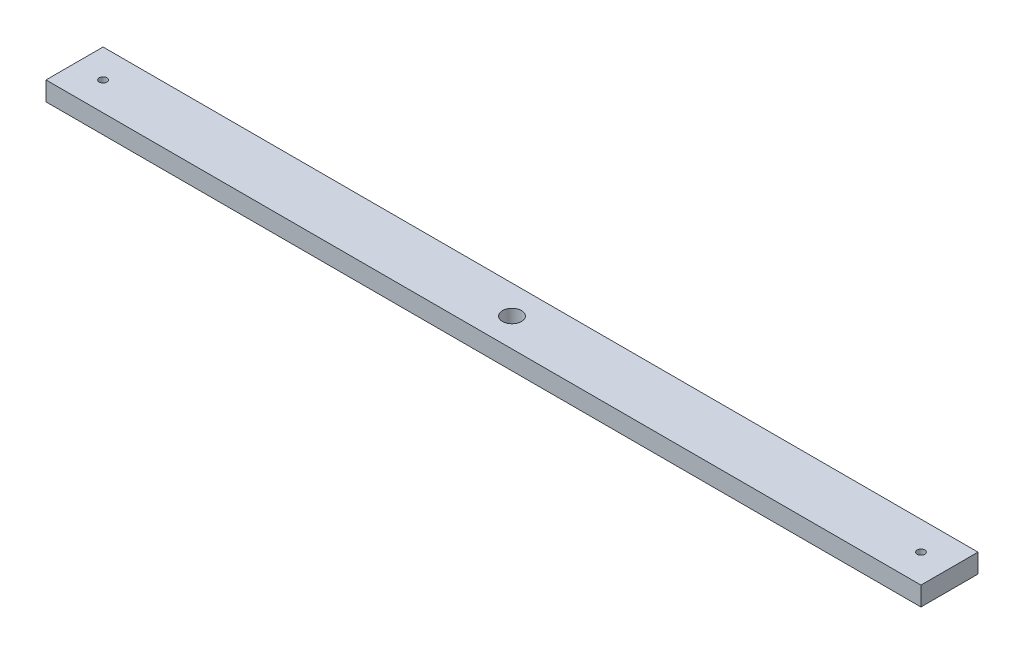
from build123d import *

# Parameters (mm, degrees)
SKETCH1_W               = 38.1
SKETCH1_H               = 12.7
BOSS_EXTRUDE1_DEPTH     = 292.1
SKETCH2_R               = 6.35
CUT_EXTRUDE1_DEPTH      = 293.995908675
F_1_4_20_TAPPED_HOLE1_D = 5.1054


with BuildPart() as part:
    # Sketch1 → Boss-Extrude1 (new, symmetric)
    with BuildSketch(Plane(origin=(0, 0, 0), x_dir=(0, 0, -1), z_dir=(1, 0, 0))):
        Rectangle(SKETCH1_W, SKETCH1_H)
    extrude(amount=BOSS_EXTRUDE1_DEPTH, both=True)

    # Sketch2 → Cut-Extrude1 (cut, through all)
    with BuildSketch(Plane(origin=(0, 6.35, 0), x_dir=(1, 0, 0), z_dir=(0, 1, 0))):
        with Locations(Location((0, 0, 0), (0, 0, 270))):
            Circle(SKETCH2_R)
    extrude(amount=-CUT_EXTRUDE1_DEPTH, mode=Mode.SUBTRACT)

    # 1/4-20 Tapped Hole1 (through all)
    with Locations(Plane(origin=(0, -6.35, 0), x_dir=(-1, 0, 0), z_dir=(0, -1, 0))):
        with Locations((273.05, 0), (-273.05, 0)):
            Hole(F_1_4_20_TAPPED_HOLE1_D / 2)


solid = part.part
